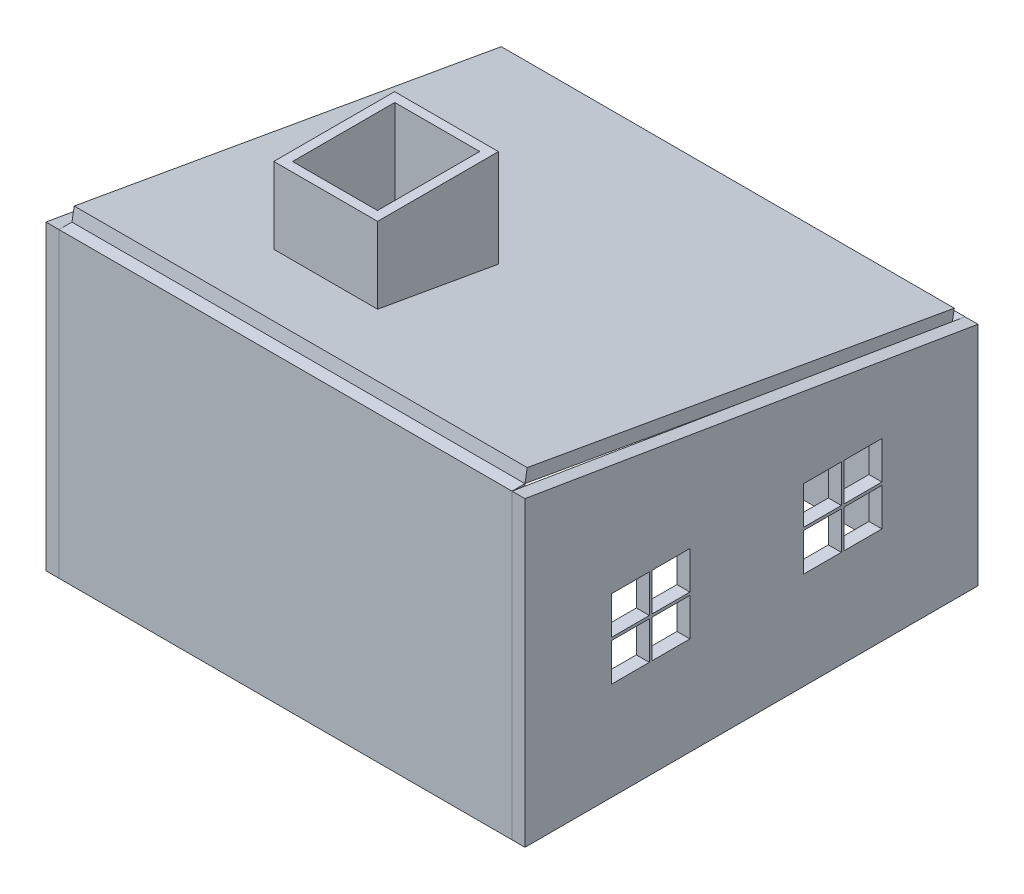
from build123d import *

# Parameters (mm, degrees)
SKETCH4_W            = 609.6
SKETCH4_H            = 304.8
BOSS_EXTRUDE2_DEPTH  = 17.4625
BOSS_EXTRUDE3_DEPTH  = 17.4625
SKETCH6_W            = 609.6
SKETCH6_H            = 406.4
BOSS_EXTRUDE4_DEPTH  = 17.4625
BOSS_EXTRUDE1_DEPTH  = 17.4625
SKETCH7_W            = 609.6
SKETCH7_H            = 583.587110571
BOSS_EXTRUDE6_DEPTH  = 17.4625
BOSS_EXTRUDE7_REACH  = 620.513
SKETCH8_W            = 139.7
SKETCH8_H            = 165.1
SKETCH8_W_2          = 114.3
SKETCH8_H_2          = 139.7
SKETCH9_W            = 50.8
SKETCH9_H            = 50.8
CUT_EXTRUDE1_DEPTH   = 876.431045614
SKETCH10_W           = 101.6
SKETCH10_H           = 165.1
BOSS_EXTRUDE8_DEPTH  = 17.4625
SKETCH11_OUTSIDE_W   = 853.086
SKETCH11_OUTSIDE_H   = 716.56
SKETCH11_OUTSIDE_W_2 = 19.05
SKETCH11_OUTSIDE_H_2 = 38.1
CUT_EXTRUDE2_DEPTH   = 8.73125
CHAMFER1_SIZE        = 3.175


with BuildPart() as part:
    # Sketch4 → Boss-Extrude2 (new body)
    with BuildSketch(Plane.XY.offset(-287.3375)):
        with Locations((0, 152.4)):
            Rectangle(SKETCH4_W, SKETCH4_H)
    extrude(amount=-BOSS_EXTRUDE2_DEPTH)


with BuildPart() as body_2:
    # Sketch5 → Boss-Extrude3 (new body)
    with BuildSketch(Plane(origin=(-304.8, 0, 0), x_dir=(0, 0, -1), z_dir=(1, 0, 0))):
        Polygon((304.8, 0), (-304.8, 0), (-304.8, 406.4), (304.8, 304.8), align=None)
    extrude(amount=-BOSS_EXTRUDE3_DEPTH)


with BuildPart() as body_3:
    # Sketch6 → Boss-Extrude4 (new body)
    with BuildSketch(Plane.XY.offset(287.3375)):
        with Locations((0, 203.2)):
            Rectangle(SKETCH6_W, SKETCH6_H)
    extrude(amount=BOSS_EXTRUDE4_DEPTH)


with BuildPart() as body_4:
    # Sketch3 → Boss-Extrude1 (new body)
    with BuildSketch(Plane(origin=(304.8, 0, 0), x_dir=(0, 0, -1), z_dir=(1, 0, 0))):
        Polygon((-304.8, 0), (304.8, 0), (304.8, 304.8), (-304.8, 406.4), align=None)
    extrude(amount=BOSS_EXTRUDE1_DEPTH)


with BuildPart() as body_5:
    # Sketch7 → Boss-Extrude6 (new body)
    with BuildSketch(Plane(origin=(0, 344.822009768, -60.963007252), x_dir=(-1, 0, 0), z_dir=(0, -0.9847287398746516, 0.17409568881761794))):
        with Locations((0, -61.908426944)):
            Rectangle(SKETCH7_W, SKETCH7_H)
    extrude(amount=-BOSS_EXTRUDE6_DEPTH)


with BuildPart() as body_6:
    # Boss-Extrude7: up to this plane
    boss_extrude7_end = Plane(origin=(0, 508, 0), z_dir=(0, 1, 0))
    # Sketch8 → Boss-Extrude7 (new, up to the surface)
    with BuildSketch(Plane(origin=(0, 362.017835388, -64.003153218), x_dir=(1, 0, 0), z_dir=(0, 0.9847287398746516, -0.17409568881761792)), mode=Mode.PRIVATE) as boss_extrude7_sk1:
        with Locations((-68.2625, -167.697807849)):
            Rectangle(SKETCH8_W, SKETCH8_H)
        with Locations((-68.2625, -167.697807849)):
            Rectangle(SKETCH8_W_2, SKETCH8_H_2, mode=Mode.SUBTRACT)
    boss_extrude7_tool1 = split(extrude(boss_extrude7_sk1.sketch, amount=BOSS_EXTRUDE7_REACH, dir=(0, 1, 0), mode=Mode.PRIVATE), bisect_by=boss_extrude7_end, keep=Keep.BOTH, mode=Mode.PRIVATE)
    add(boss_extrude7_tool1.solids().sort_by_distance((-68.2625, 377.218224, 21.974045))[0])


with BuildPart() as cut_extrude1_tool:
    # Sketch9 → Cut-Extrude1 (new, through all)
    with BuildSketch(Plane.ZY.offset(322.2625)):
        with Locations((-150.124906912, 210.96048109)):
            Rectangle(SKETCH9_W, SKETCH9_H)
        with Locations((-150.124906912, 156.328437529)):
            Rectangle(SKETCH9_W, SKETCH9_H)
        with Locations((-95.492863351, 210.96048109)):
            Rectangle(SKETCH9_W, SKETCH9_H)
        with Locations((-95.492863351, 156.328437529)):
            Rectangle(SKETCH9_W, SKETCH9_H)
        with Locations((108.233894506, 157.315605476)):
            Rectangle(SKETCH9_W, SKETCH9_H)
        with Locations((108.233894506, 211.947649037)):
            Rectangle(SKETCH9_W, SKETCH9_H)
        with Locations((162.865938066, 211.947649037)):
            Rectangle(SKETCH9_W, SKETCH9_H)
        with Locations((162.865938066, 157.315605476)):
            Rectangle(SKETCH9_W, SKETCH9_H)
    extrude(amount=-CUT_EXTRUDE1_DEPTH)


with BuildPart() as body_2_1:
    add(body_2.part)

    # Cut-Extrude1: cut by cut_extrude1_tool
    add(cut_extrude1_tool.part, mode=Mode.SUBTRACT)


with BuildPart() as body_4_1:
    add(body_4.part)

    # Cut-Extrude1: cut by cut_extrude1_tool
    add(cut_extrude1_tool.part, mode=Mode.SUBTRACT)


with BuildPart() as body_7:
    # Sketch10 → Boss-Extrude8 (new body)
    with BuildSketch(Plane(origin=(0, 0, -304.8), x_dir=(-1, 0, 0), z_dir=(0, 0, -1))):
        with Locations((0, 82.55)):
            Rectangle(SKETCH10_W, SKETCH10_H)
    extrude(amount=BOSS_EXTRUDE8_DEPTH)

    # Sketch11 outside → Cut-Extrude2 (cut)
    with BuildSketch(Plane(origin=(0, 0, -322.2625), x_dir=(-1, 0, 0), z_dir=(0, 0, -1))):
        with Locations((0, 254)):
            Rectangle(SKETCH11_OUTSIDE_W, SKETCH11_OUTSIDE_H)
        with Locations((-25.4, 127)):
            Rectangle(SKETCH11_OUTSIDE_W_2, SKETCH11_OUTSIDE_H_2, mode=Mode.SUBTRACT)
        with Locations((25.4, 127)):
            Rectangle(SKETCH11_OUTSIDE_W_2, SKETCH11_OUTSIDE_H_2, mode=Mode.SUBTRACT)
        with Locations((25.4, 38.1)):
            Rectangle(SKETCH11_OUTSIDE_W_2, SKETCH11_OUTSIDE_H_2, mode=Mode.SUBTRACT)
        with Locations((-25.4, 38.1)):
            Rectangle(SKETCH11_OUTSIDE_W_2, SKETCH11_OUTSIDE_H_2, mode=Mode.SUBTRACT)
    extrude(amount=-CUT_EXTRUDE2_DEPTH, mode=Mode.SUBTRACT)

    # Chamfer1
    chamfer1_edges = [body_7.edges().sort_by_distance(p)[0] for p in [
        (15.875, 127, -322.2625),
        (25.4, 107.95, -322.2625),
        (34.925, 127, -322.2625),
        (25.4, 146.05, -322.2625),
        (-34.925, 127, -322.2625),
        (-25.4, 107.95, -322.2625),
        (-15.875, 127, -322.2625),
        (-25.4, 146.05, -322.2625),
        (-15.875, 38.1, -322.2625),
        (-25.4, 57.15, -322.2625),
        (-34.925, 38.1, -322.2625),
        (-25.4, 19.05, -322.2625),
        (34.925, 38.1, -322.2625),
        (25.4, 57.15, -322.2625),
        (15.875, 38.1, -322.2625),
        (25.4, 19.05, -322.2625),
    ]]
    chamfer(chamfer1_edges, length=CHAMFER1_SIZE)


solid = Compound([part.part, body_3.part, body_5.part, body_6.part, body_2_1.part, body_4_1.part, body_7.part])
